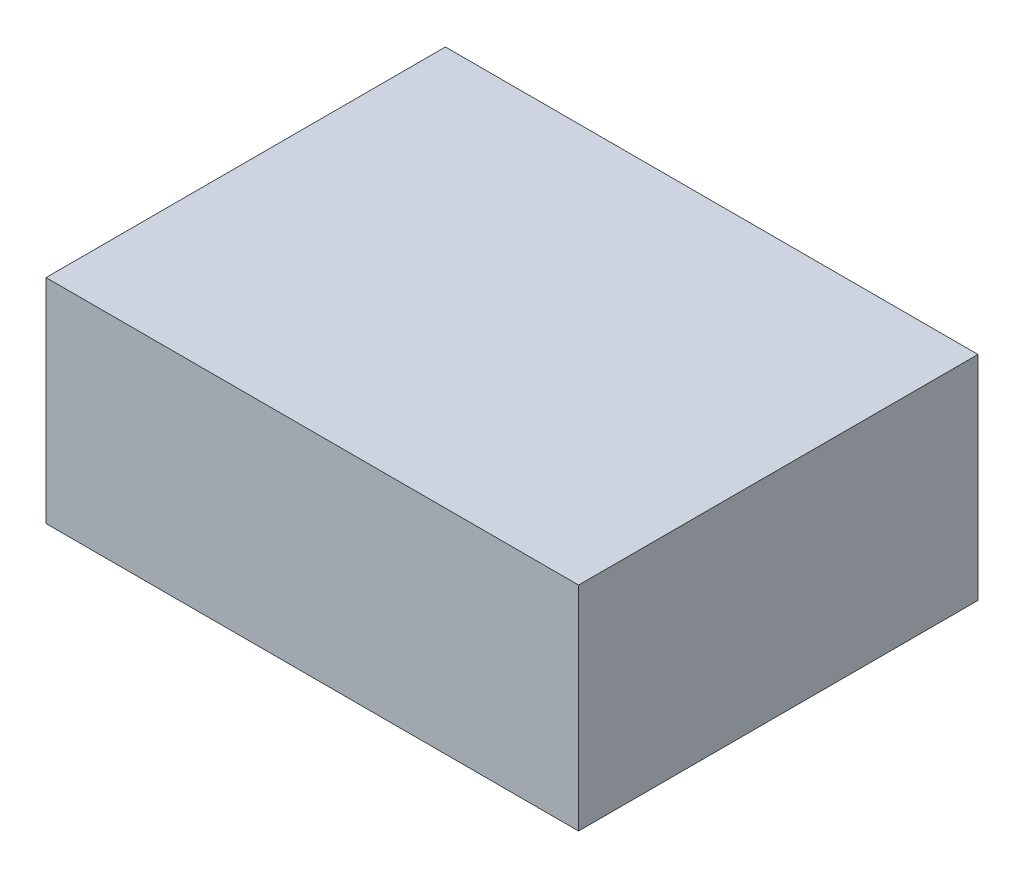
from build123d import *

# Parameters (mm, degrees)
CROQUIS1_W              = 20
CROQUIS1_H              = 15
SALIENTE_EXTRUIR1_DEPTH = 8


with BuildPart() as part:
    # Croquis1 → Saliente-Extruir1 (new body)
    with BuildSketch(Plane(origin=(0, 0, 0), x_dir=(1, 0, 0), z_dir=(0, 1, 0))):
        Rectangle(CROQUIS1_W, CROQUIS1_H)
    extrude(amount=-SALIENTE_EXTRUIR1_DEPTH)


solid = part.part
